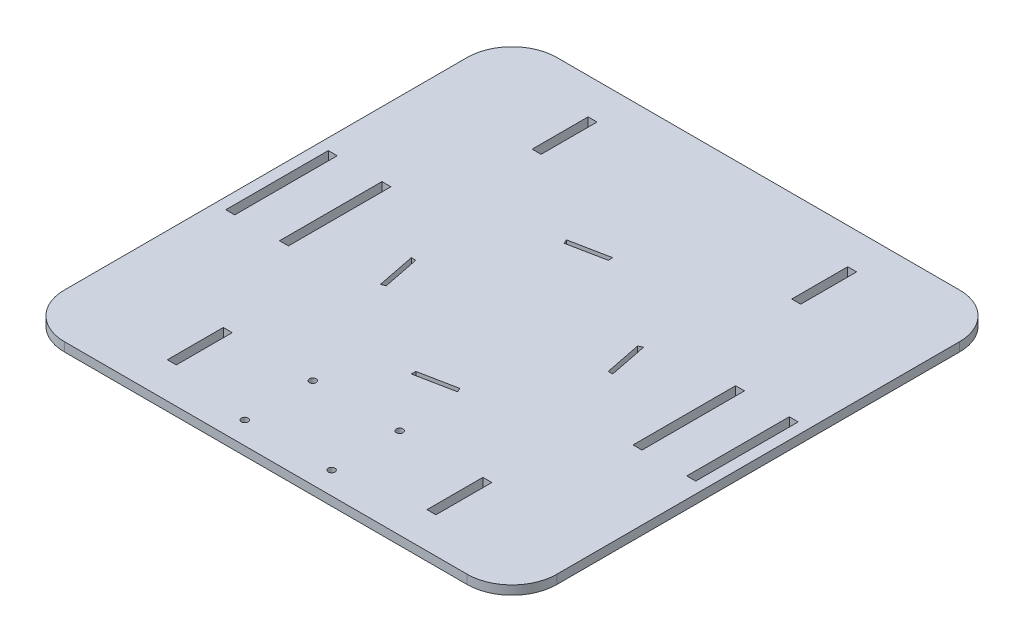
from build123d import *

# Parameters (mm, degrees)
SKETCH1_W           = 279.4
SKETCH1_H           = 279.4
BOSS_EXTRUDE1_DEPTH = 5.08
FILLET1_R           = 25.4
SKETCH2_W           = 5.08
SKETCH2_H           = 31.75
CUT_EXTRUDE1_DEPTH  = 396.163923455
SKETCH3_W           = 5.08
SKETCH3_H           = 58.166
CUT_EXTRUDE2_DEPTH  = 396.163923455
SKETCH5_R           = 1.905
CUT_EXTRUDE4_DEPTH  = 396.163923455
CUT_EXTRUDE6_DEPTH  = 396.163923455


with BuildPart() as part:
    # Sketch1 → Boss-Extrude1 (new body)
    with BuildSketch(Plane(origin=(0, 0, 0), x_dir=(1, 0, 0), z_dir=(0, 1, 0))):
        with Locations((139.7, 139.7)):
            Rectangle(SKETCH1_W, SKETCH1_H)
    extrude(amount=BOSS_EXTRUDE1_DEPTH)

    # Fillet1
    fillet1_edges = [part.edges().sort_by_distance(p)[0] for p in [
        (0, 2.54, -279.4),
        (279.4, 2.54, -279.4),
        (279.4, 2.54, 0),
        (0, 2.54, 0),
    ]]
    fillet(fillet1_edges, radius=FILLET1_R)

    # Sketch2 → Cut-Extrude1 (cut, through all)
    with BuildSketch(Plane(origin=(0, 5.08, 0), x_dir=(1, 0, 0), z_dir=(0, 1, 0))):
        with Locations((66.04, 243.205)):
            Rectangle(SKETCH2_W, SKETCH2_H)
        with Locations((213.36, 243.205)):
            Rectangle(SKETCH2_W, SKETCH2_H)
        with Locations((66.04, 36.195)):
            Rectangle(SKETCH2_W, SKETCH2_H)
        with Locations((213.36, 36.195)):
            Rectangle(SKETCH2_W, SKETCH2_H)
    extrude(amount=-CUT_EXTRUDE1_DEPTH, mode=Mode.SUBTRACT)

    # Sketch3 → Cut-Extrude2 (cut, through all)
    with BuildSketch(Plane(origin=(0, 5.08, 0), x_dir=(1, 0, 0), z_dir=(0, 1, 0))):
        with Locations((8.89, 139.7)):
            Rectangle(SKETCH3_W, SKETCH3_H)
        with Locations((270.51, 139.7)):
            Rectangle(SKETCH3_W, SKETCH3_H)
        with Locations((39.37, 139.7)):
            Rectangle(SKETCH3_W, SKETCH3_H)
        with Locations((240.03, 139.7)):
            Rectangle(SKETCH3_W, SKETCH3_H)
    extrude(amount=-CUT_EXTRUDE2_DEPTH, mode=Mode.SUBTRACT)

    # Sketch5 → Cut-Extrude4 (cut, through all)
    with BuildSketch(Plane.XZ):
        with Locations(Location((115.062, -12.7, 0), (0, 0, 270))):
            Circle(SKETCH5_R)
        with Locations(Location((164.338, -12.7, 0), (0, 0, 270))):
            Circle(SKETCH5_R)
        with Locations(Location((164.338, -51.308, 0), (0, 0, 270))):
            Circle(SKETCH5_R)
        with Locations(Location((115.062, -51.308, 0), (0, 0, 270))):
            Circle(SKETCH5_R)
    extrude(amount=-CUT_EXTRUDE4_DEPTH, mode=Mode.SUBTRACT)

    # Sketch6 → Cut-Extrude6 (cut, through all)
    with BuildSketch(Plane(origin=(0, 5.08, 0), x_dir=(1, 0, 0), z_dir=(0, 1, 0))):
        Polygon((117.82964184, 192.499715283), (118.801657759, 190.15306127), (139.7, 194.31), (139.7, 196.85), align=None)
        Polygon((82.55, 139.7), (86.900284717, 117.82964184), (89.24693873, 118.801657759), (85.09, 139.7), align=None)
        Polygon((160.598342241, 89.24693873), (161.57035816, 86.900284717), (139.7, 82.55), (139.7, 85.09), align=None)
        Polygon((196.85, 139.7), (192.499715283, 161.57035816), (190.15306127, 160.598342241), (194.31, 139.7), align=None)
    extrude(amount=-CUT_EXTRUDE6_DEPTH, mode=Mode.SUBTRACT)


solid = part.part
